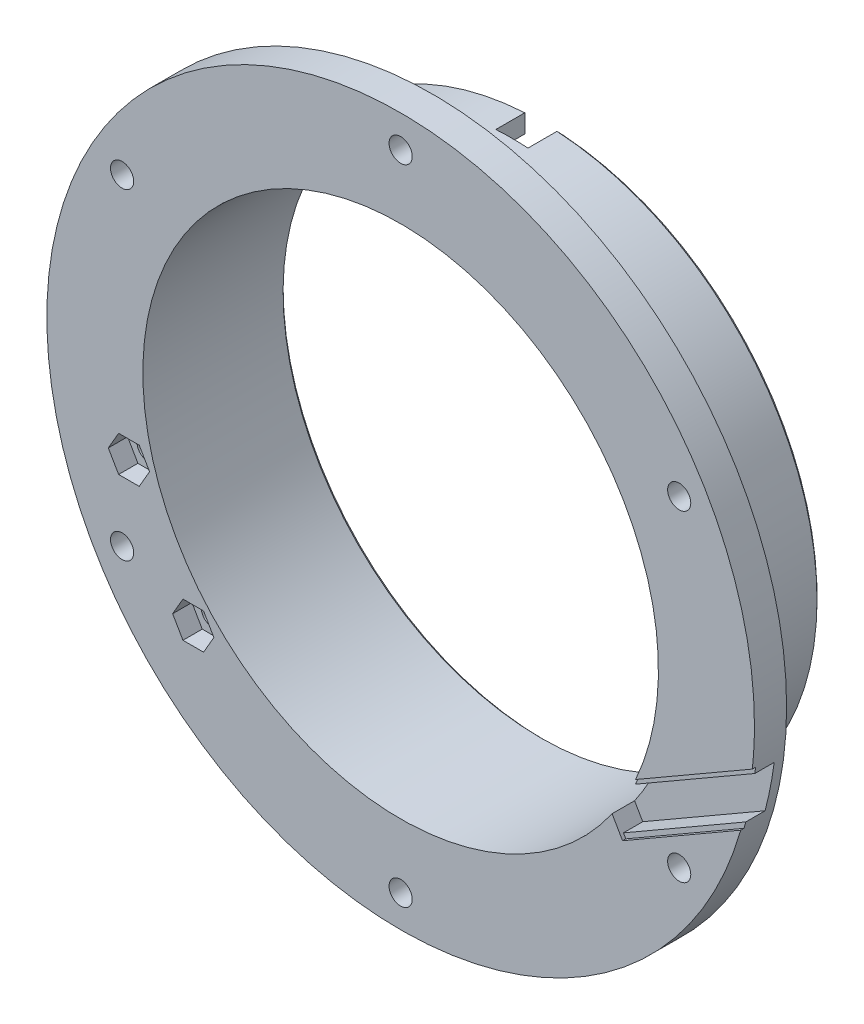
from build123d import *

# Parameters (mm, degrees)
SKETCH2_R           = 1.8
CUT_EXTRUDE1_DEPTH  = 11
CUT_EXTRUDE2_DEPTH  = 5
SKETCH4_OUTSIDE_W   = 143.43
SKETCH4_OUTSIDE_H   = 143.43
SKETCH4_OUTSIDE_R   = 42.925
CUT_EXTRUDE3_DEPTH  = 17.3
SKETCH6_R           = 40.075
CUT_EXTRUDE5_DEPTH  = 81.915326113
CHAMFER1_SIZE       = 0.5
CUT_EXTRUDE6_DEPTH  = 3.5
CUT_EXTRUDE7_DEPTH  = 3
SKETCH9_R           = 1.75
CUT_EXTRUDE9_DEPTH  = 5
CUT_EXTRUDE10_DEPTH = 0.5


with BuildPart() as part:
    # Sketch1 → Revolve1 (revolve)
    with BuildSketch(Plane(origin=(0, 0, 0), x_dir=(1, 0, 0), z_dir=(0, 1, 0))):
        Polygon((35, 0), (35, -22.3), (55, -22.3), (55, -17.3), (49, -17.3), (49, 0), align=None)
    revolve(axis=Axis((0, 0, 94.21875), (0, 0, -1)))

    # Sketch2 → Cut-Extrude1 (cut)
    with BuildSketch(Plane.XY.offset(22.3)):
        with Locations((0, 50)):
            Circle(SKETCH2_R)
        with Locations((43.301270189, 25)):
            Circle(SKETCH2_R)
        with Locations((43.301270189, -25)):
            Circle(SKETCH2_R)
        with Locations((0, -50)):
            Circle(SKETCH2_R)
        with Locations((-43.301270189, -25)):
            Circle(SKETCH2_R)
        with Locations((-43.301270189, 25)):
            Circle(SKETCH2_R)
    extrude(amount=-CUT_EXTRUDE1_DEPTH, mode=Mode.SUBTRACT)

    # Sketch3 → Cut-Extrude2 (cut)
    with BuildSketch(Plane.XY):
        with BuildLine():
            Line((2.5, 48.936182932), (2.5, 34.910600109))
            ThreePointArc((2.5, 34.910600109), (0, 35), (-2.5, 34.910600109))
            Line((-2.5, 34.910600109), (-2.5, 48.936182932))
            ThreePointArc((-2.5, 48.936182932), (0, 49), (2.5, 48.936182932))
        make_face()
    extrude(amount=CUT_EXTRUDE2_DEPTH, mode=Mode.SUBTRACT)

    # Sketch4 outside → Cut-Extrude3 (cut)
    with BuildSketch(Plane(origin=(0, 0, 0), x_dir=(-1, 0, 0), z_dir=(0, 0, -1))):
        Rectangle(SKETCH4_OUTSIDE_W, SKETCH4_OUTSIDE_H)
        Circle(SKETCH4_OUTSIDE_R, mode=Mode.SUBTRACT)
    extrude(amount=-CUT_EXTRUDE3_DEPTH, mode=Mode.SUBTRACT)

    # Sketch6 → Cut-Extrude5 (cut, through all)
    with BuildSketch(Plane.XY):
        with Locations(Location((0, 0, 0), (0, 0, 93.576606812))):
            Circle(SKETCH6_R)
    extrude(amount=CUT_EXTRUDE5_DEPTH, mode=Mode.SUBTRACT)

    # Chamfer1
    chamfer1_edges = [part.edges().sort_by_distance(p)[0] for p in [
        (2.5, 41.424540979, 0),
        (0, -40.075, 0),
        (-2.5, 41.424540979, 0),
        (29.455416522, -31.223934129, 0),
    ]]
    chamfer(chamfer1_edges, length=CHAMFER1_SIZE)

    # Sketch7 → Cut-Extrude6 (cut)
    with BuildSketch(Plane.XY.offset(22.3)):
        Polygon((31.359931864, -20.316995311), (34.134931864, -25.123436302), (58.38364317, -11.123436302), (55.60864317, -6.316995311), align=None)
    extrude(amount=-CUT_EXTRUDE6_DEPTH, mode=Mode.SUBTRACT)

    # Sketch8 → Cut-Extrude7 (cut)
    with BuildSketch(Plane.XY.offset(22.3)):
        Polygon((-29.034798369, -30.160254038), (-30.636945366, -32.935254038), (-33.84123936, -32.935254038), (-35.443386357, -30.160254038), (-33.84123936, -27.385254038), (-30.636945366, -27.385254038), align=None)
        Polygon((-43.84123936, -10.064745962), (-45.443386357, -12.839745962), (-43.84123936, -15.614745962), (-40.636945366, -15.614745962), (-39.034798369, -12.839745962), (-40.636945366, -10.064745962), align=None)
    extrude(amount=-CUT_EXTRUDE7_DEPTH, mode=Mode.SUBTRACT)

    # Sketch9 → Cut-Extrude9 (cut)
    with BuildSketch(Plane.XY.offset(22.3)):
        with Locations((-42.239092363, -12.839745962)):
            Circle(SKETCH9_R)
        with Locations(Location((-32.239092363, -30.160254038, 0), (0, 0, 358.221796194))):
            Circle(SKETCH9_R)
    extrude(amount=-CUT_EXTRUDE9_DEPTH, mode=Mode.SUBTRACT)

    # Sketch10 → Cut-Extrude10 (cut)
    with BuildSketch(Plane.XY.offset(22.3)):
        Polygon((30.997431864, -19.689126893), (34.497431864, -25.75130472), (59.162085788, -11.511160138), (55.662085788, -5.448982311), align=None)
    extrude(amount=-CUT_EXTRUDE10_DEPTH, mode=Mode.SUBTRACT)


solid = part.part
